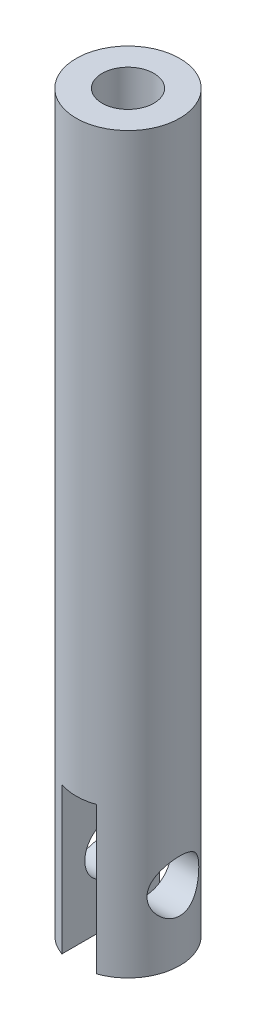
from build123d import *

# Parameters (mm, degrees)
SKETCH1_R               = 6
SKETCH1_R_2             = 1.5
BOSS_EXTRUDE1_DEPTH     = 75
SKETCH2_R               = 1.5
CUT_EXTRUDE1_DEPTH      = 75
BOSS_EXTRUDE2_START     = 10
SKETCH4_R               = 6
SKETCH4_R_2             = 1.5
BOSS_EXTRUDE2_DEPTH     = 10
SKETCH5_W               = 4
SKETCH5_H               = 27.545605052
CUT_EXTRUDE2_DEPTH      = 17
CUT_EXTRUDE4_DEPTH      = 15
CUT_EXTRUDE4_DEPTH_BACK = 15
SKETCH7_R               = 3
SKETCH8_R               = 3
CUT_EXTRUDE5_DEPTH      = 14


with BuildPart() as part:
    # Sketch1 → Boss-Extrude1 (new body)
    with BuildSketch(Plane(origin=(0, 0, 0), x_dir=(1, 0, 0), z_dir=(0, 1, 0))):
        Circle(SKETCH1_R)
        Circle(SKETCH1_R_2, mode=Mode.SUBTRACT)
    extrude(amount=BOSS_EXTRUDE1_DEPTH)

    # Sketch2 → Cut-Extrude1 (cut)
    with BuildSketch(Plane.XY):
        with Locations((0, 23.5)):
            Circle(SKETCH2_R)
        with Locations((0, 54)):
            Circle(SKETCH2_R)
    extrude(amount=-CUT_EXTRUDE1_DEPTH, mode=Mode.SUBTRACT)

    # Sketch4 → Boss-Extrude2 (add)
    with BuildSketch(Plane.XZ.offset(BOSS_EXTRUDE2_START)):
        Circle(SKETCH4_R)
        Circle(SKETCH4_R_2, mode=Mode.SUBTRACT)
    extrude(amount=-BOSS_EXTRUDE2_DEPTH)

    # Sketch5 → Cut-Extrude2 (cut)
    with BuildSketch(Plane.XZ.offset(10)):
        Rectangle(SKETCH5_W, SKETCH5_H)
    extrude(amount=-CUT_EXTRUDE2_DEPTH, mode=Mode.SUBTRACT)

    # Sketch7 → Cut-Extrude4 (cut, two sides: drawn at the far end of the back side and taken through both)
    with BuildSketch(Plane(origin=(-2, 0, 0), x_dir=(0, 0, -1), z_dir=(1, 0, 0)).offset(-CUT_EXTRUDE4_DEPTH_BACK)):
        with Locations((0, -2)):
            Circle(SKETCH7_R)
    extrude(amount=CUT_EXTRUDE4_DEPTH + CUT_EXTRUDE4_DEPTH_BACK, mode=Mode.SUBTRACT)

    # Sketch8 → Cut-Extrude5 (cut)
    with BuildSketch(Plane(origin=(0, 75, 0), x_dir=(1, 0, 0), z_dir=(0, 1, 0))):
        Circle(SKETCH8_R)
    extrude(amount=-CUT_EXTRUDE5_DEPTH, mode=Mode.SUBTRACT)


solid = part.part
